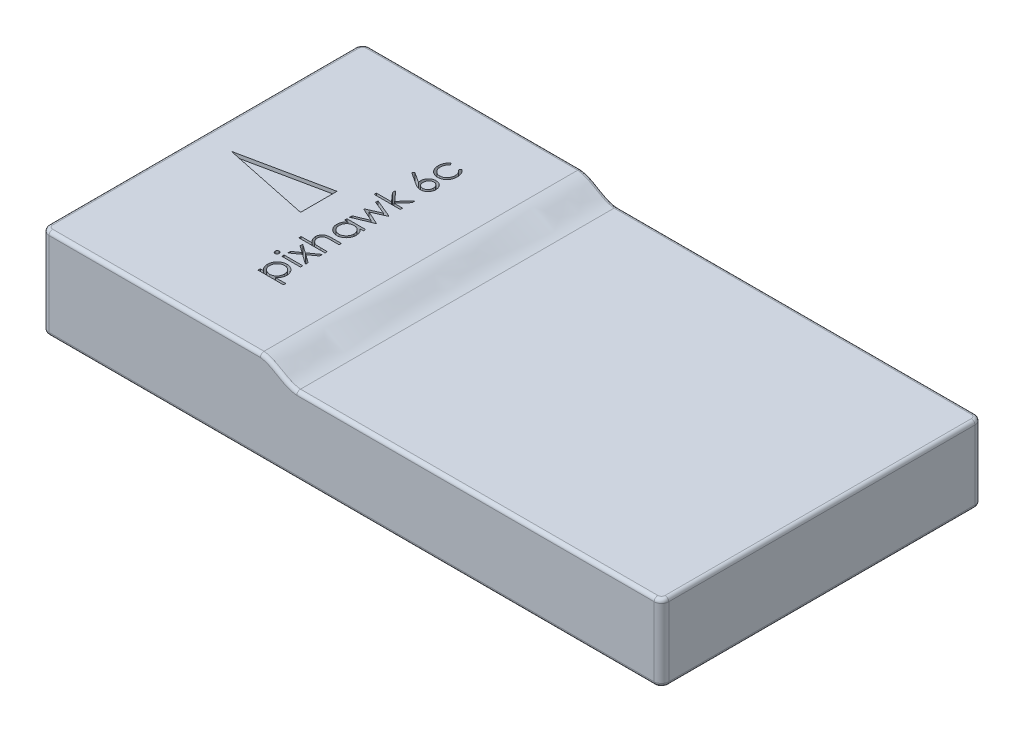
from build123d import *

# Parameters (mm, degrees)
SKETCH1_W               = 85
SKETCH1_H               = 44
BOSS_EXTRUDE1_DEPTH     = 15
CUT_EXTRUDE1_DEPTH      = 51.152268144
CUT_EXTRUDE1_DEPTH_BACK = 51.152268144
SKETCH3_W               = 2.557692308
SKETCH3_H               = 0.314102564
CUT_EXTRUDE2_DEPTH      = 2
FILLET1_R               = 1
FILLET2_R               = 0.5
FILLET3_R               = 0.5
CUT_EXTRUDE3_DEPTH      = 0.5


with BuildPart() as part:
    # Sketch1 → Boss-Extrude1 (new body)
    with BuildSketch(Plane(origin=(0, 0, 0), x_dir=(1, 0, 0), z_dir=(0, 1, 0))):
        Rectangle(SKETCH1_W, SKETCH1_H)
    extrude(amount=BOSS_EXTRUDE1_DEPTH)

    # Sketch2 → Cut-Extrude1 (cut, two sides: drawn at the far end of the back side and taken through both)
    with BuildSketch(Plane.XY.offset(-CUT_EXTRUDE1_DEPTH_BACK)):
        with BuildLine():
            Line((-42.5, 12.5), (-12.5, 12.5))
            add(Edge.make_bspline(
                [(-12.5, 12.5), (-10.623415355, 12.323006837), (-9.376584645, 10.676993163), (-7.5, 10.5)],
                knots=[0, 0, 0, 0, 1, 1, 1, 1], degree=3))
            Line((-7.5, 10.5), (42.5, 10.5))
            Line((42.5, 10.5), (42.5, 22.5))
            Line((42.5, 22.5), (-42.5, 22.5))
            Line((-42.5, 22.5), (-42.5, 12.5))
        make_face()
    extrude(amount=CUT_EXTRUDE1_DEPTH + CUT_EXTRUDE1_DEPTH_BACK, mode=Mode.SUBTRACT)

    # Sketch3 → Cut-Extrude2 (cut)
    # profile 1 of 10: a face of its own
    with BuildSketch(Plane(origin=(0, 12.5, 0), x_dir=(1, 0, 0), z_dir=(0, 1, 0))):
        with BuildLine():
            Line((-22.003104968, 13.653846154), (-21.83974359, 13.390925481))
            add(Edge.make_bspline(
                [(-21.83974359, 13.390925481), (-21.875571984, 13.362095615), (-21.946094094, 13.30534892), (-22.037104027, 13.206809684), (-22.115271069, 13.10179827), (-22.17897482, 12.988520222), (-22.22819627, 12.867134422), (-22.263026476, 12.738119571), (-22.284730719, 12.601494066), (-22.287197555, 12.507828867), (-22.288461538, 12.459835737)],
                knots=[0, 0, 0, 0, 1.026593902, 2.0206758, 2.988051866, 3.946915611, 4.916868779, 5.907761954, 6.927957743, 8, 8, 8, 8], degree=3))
            add(Edge.make_bspline(
                [(-22.288461538, 12.459835737), (-22.287404696, 12.42147678), (-22.285323274, 12.345929858), (-22.272312781, 12.235023704), (-22.248670773, 12.129381351), (-22.217519816, 12.028340642), (-22.175769526, 11.932620224), (-22.12495977, 11.841969305), (-22.06590973, 11.755583815), (-21.997499184, 11.675967074), (-21.923100516, 11.603138067), (-21.843346821, 11.540039153), (-21.76062693, 11.48510222), (-21.672875188, 11.441996263), (-21.582099134, 11.406721093), (-21.486585279, 11.383514373), (-21.387557271, 11.368049677), (-21.320038931, 11.366280348), (-21.285857372, 11.365384615)],
                knots=[0, 0, 0, 0, 1.112346261, 2.190735716, 3.231507886, 4.247384806, 5.251966152, 6.253067467, 7.256802811, 8.280671706, 9.291813951, 10.270744147, 11.225547591, 12.165006084, 13.100104208, 14.043489273, 15.009504848, 16, 16, 16, 16], degree=3))
            add(Edge.make_bspline(
                [(-21.285857372, 11.365384615), (-21.241094559, 11.367190834), (-21.151943011, 11.370788176), (-21.020567246, 11.39814875), (-20.89378287, 11.443930198), (-20.772275303, 11.505778812), (-20.65969093, 11.584285426), (-20.558704882, 11.676450175), (-20.471289548, 11.782371348), (-20.398816831, 11.901103103), (-20.340555516, 12.029861005), (-20.299048169, 12.167251066), (-20.273995801, 12.312150859), (-20.270839857, 12.411357604), (-20.269230769, 12.461939103)],
                knots=[0, 0, 0, 0, 0.96628757, 1.924499989, 2.884001032, 3.87047137, 4.860396324, 5.839257425, 6.814467993, 7.816059692, 8.834901047, 9.858382822, 10.908076205, 12, 12, 12, 12], degree=3))
            add(Edge.make_bspline(
                [(-20.269230769, 12.461939103), (-20.270530266, 12.508294287), (-20.273084123, 12.599394525), (-20.294613087, 12.73256181), (-20.32985672, 12.859341721), (-20.37900437, 12.979729752), (-20.442531886, 13.093505918), (-20.520891057, 13.199935093), (-20.611827657, 13.301135031), (-20.682145629, 13.360632008), (-20.717948718, 13.390925481)],
                knots=[0, 0, 0, 0, 1.039848629, 2.043578496, 3.018386758, 3.987534228, 4.954977003, 5.934852016, 6.948509513, 8, 8, 8, 8], degree=3))
            Line((-20.717948718, 13.390925481), (-20.545472756, 13.653846154))
            add(Edge.make_bspline(
                [(-20.545472756, 13.653846154), (-20.522582029, 13.638258452), (-20.476876553, 13.607134785), (-20.412432436, 13.555107159), (-20.352110754, 13.498987328), (-20.295992364, 13.438994231), (-20.242734345, 13.375911221), (-20.19488277, 13.307583311), (-20.149747947, 13.2362137), (-20.109135075, 13.160964542), (-20.072628754, 13.082613844), (-20.041237583, 13.001271854), (-20.014267477, 12.917292042), (-19.99283013, 12.830575666), (-19.975719292, 12.740951767), (-19.96436559, 12.648652133), (-19.955890309, 12.553708551), (-19.955384442, 12.4895364), (-19.955128205, 12.45703125)],
                knots=[0, 0, 0, 0, 0.954134338, 1.905101784, 2.851144739, 3.791306361, 4.734911809, 5.6936923, 6.663572882, 7.643865596, 8.638447847, 9.640600242, 10.646758161, 11.676244097, 12.717260333, 13.78922464, 14.880174919, 16, 16, 16, 16], degree=3))
            add(Edge.make_bspline(
                [(-19.955128205, 12.45703125), (-19.956020966, 12.407421015), (-19.957770783, 12.310184595), (-19.976958368, 12.167852931), (-20.005991844, 12.031872514), (-20.047309347, 11.902004379), (-20.101873852, 11.77904249), (-20.166998533, 11.661963185), (-20.244835572, 11.551974645), (-20.333535822, 11.449797919), (-20.429805581, 11.356357336), (-20.533088574, 11.275049334), (-20.641102547, 11.206143342), (-20.754528339, 11.149380838), (-20.87290085, 11.104997856), (-20.996943228, 11.074441753), (-21.125603037, 11.054725918), (-21.213334882, 11.052440629), (-21.2578125, 11.051282051)],
                knots=[0, 0, 0, 0, 1.113096611, 2.181677437, 3.217994567, 4.231807234, 5.234933164, 6.233258928, 7.234764453, 8.254006763, 9.267004511, 10.242118657, 11.199842941, 12.138404996, 13.084707599, 14.031460992, 15.002005182, 16, 16, 16, 16], degree=3))
            add(Edge.make_bspline(
                [(-21.2578125, 11.051282051), (-21.287990935, 11.051723067), (-21.348020822, 11.052600321), (-21.437115889, 11.062662249), (-21.525024434, 11.075660722), (-21.610632153, 11.097686459), (-21.695237443, 11.123127091), (-21.777820545, 11.155602623), (-21.858765217, 11.193698017), (-21.937862947, 11.236949965), (-22.013812487, 11.28563871), (-22.085566151, 11.339519943), (-22.153985917, 11.396564279), (-22.216709677, 11.459440391), (-22.276245869, 11.525480045), (-22.331003993, 11.596551621), (-22.381144984, 11.672247473), (-22.427595999, 11.751430795), (-22.468955434, 11.834055506), (-22.504588672, 11.919622177), (-22.535041248, 12.007615206), (-22.559150167, 12.09817535), (-22.579367591, 12.190701523), (-22.592085437, 12.285922861), (-22.60107171, 12.383475084), (-22.602062502, 12.449531106), (-22.602564103, 12.482972756)],
                knots=[0, 0, 0, 0, 0.990994727, 1.971252077, 2.943264845, 3.907940874, 4.872158414, 5.844625996, 6.82015047, 7.809835459, 8.804511986, 9.781214284, 10.756496977, 11.728388426, 12.696359165, 13.676225489, 14.672885716, 15.677705647, 16.690706858, 17.706033469, 18.721040654, 19.747369689, 20.783475414, 21.830280724, 22.901553713, 24, 24, 24, 24], degree=3))
            add(Edge.make_bspline(
                [(-22.602564103, 12.482972756), (-22.601642307, 12.524852917), (-22.599803323, 12.6084039), (-22.584323254, 12.732343834), (-22.560992168, 12.854461935), (-22.526399552, 12.972598247), (-22.484607014, 13.08538355), (-22.43739326, 13.190679098), (-22.38372785, 13.28689472), (-22.323939338, 13.37487909), (-22.255830681, 13.45460783), (-22.180095138, 13.528124413), (-22.096187562, 13.595913209), (-22.034388568, 13.6343758), (-22.003104968, 13.653846154)],
                knots=[0, 0, 0, 0, 1.095139042, 2.184804066, 3.262657822, 4.34424993, 5.400369085, 6.407210964, 7.359649996, 8.278719237, 9.185177137, 10.097389079, 11.036869154, 12, 12, 12, 12], degree=3))
        make_face()
    # profile 2 of 10: a face of its own
    with BuildSketch(Plane(origin=(0, 12.5, 0), x_dir=(1, 0, 0), z_dir=(0, 1, 0))):
        with BuildLine():
            Line((-23.58974359, 9.83974359), (-23.399739583, 10.081630609))
            Line((-23.399739583, 10.081630609), (-21.985576923, 9.156850962))
            add(Edge.make_bspline(
                [(-21.985576923, 9.156850962), (-21.995390784, 9.218421239), (-22.014533829, 9.338521025), (-22.017691774, 9.460086924), (-22.019230769, 9.519330929)],
                knots=[0, 0, 0, 0, 1.025318673, 2, 2, 2, 2], degree=3))
            add(Edge.make_bspline(
                [(-22.019230769, 9.519330929), (-22.018274658, 9.554903426), (-22.01639258, 9.624926826), (-22.001908729, 9.727733628), (-21.979083619, 9.826522567), (-21.945811357, 9.920884166), (-21.903309025, 10.0111572), (-21.852370067, 10.097859398), (-21.790364723, 10.179362165), (-21.721098473, 10.256710428), (-21.644386305, 10.326948381), (-21.56296755, 10.389085175), (-21.476848647, 10.441564888), (-21.386048964, 10.483375767), (-21.291279266, 10.516790063), (-21.192169945, 10.540576975), (-21.088553728, 10.554797149), (-21.018073453, 10.556717055), (-20.982271635, 10.557692308)],
                knots=[0, 0, 0, 0, 1.043709831, 2.054511743, 3.041122595, 4.01515914, 4.98481438, 5.965901842, 6.960491961, 7.985277438, 9.0096037, 10.00832444, 10.987059228, 11.962929573, 12.936966118, 13.931840027, 14.949438142, 16, 16, 16, 16], degree=3))
            add(Edge.make_bspline(
                [(-20.982271635, 10.557692308), (-20.933290098, 10.556272661), (-20.836906025, 10.553479133), (-20.696555504, 10.525525931), (-20.562926162, 10.482413619), (-20.438330275, 10.419805153), (-20.321904881, 10.343512353), (-20.219084187, 10.249331286), (-20.127384518, 10.141934693), (-20.050736149, 10.020434838), (-19.988130859, 9.889695417), (-19.943166211, 9.75234248), (-19.915482586, 9.60971558), (-19.912012004, 9.512910939), (-19.91025641, 9.463942308)],
                knots=[0, 0, 0, 0, 1.031403119, 2.029557249, 3.004870281, 3.983165322, 4.960181699, 5.929903783, 6.912123683, 7.928973898, 8.949315281, 9.960468141, 10.968302741, 12, 12, 12, 12], degree=3))
            add(Edge.make_bspline(
                [(-19.91025641, 9.463942308), (-19.911780273, 9.416843625), (-19.914798779, 9.32354938), (-19.941828234, 9.186345578), (-19.985326767, 9.054275989), (-20.046510348, 8.929035908), (-20.122487554, 8.812827334), (-20.213316504, 8.708030565), (-20.319123382, 8.617454236), (-20.437593599, 8.541397383), (-20.564720568, 8.480818115), (-20.69750636, 8.43581331), (-20.835393511, 8.409386314), (-20.928876381, 8.405701905), (-20.975961538, 8.403846154)],
                knots=[0, 0, 0, 0, 1.012172929, 2.004937354, 2.995255351, 3.995689452, 4.993936421, 5.973737378, 6.968231049, 7.979117505, 8.993136101, 9.989812463, 10.987515067, 12, 12, 12, 12], degree=3))
            add(Edge.make_bspline(
                [(-20.975961538, 8.403846154), (-21.012006122, 8.405027599), (-21.085602274, 8.407439884), (-21.197066302, 8.424283274), (-21.311117383, 8.451348069), (-21.407871577, 8.481658315), (-21.487133099, 8.513683925), (-21.55103659, 8.540336465), (-21.616797663, 8.573510461), (-21.686671299, 8.608883842), (-21.758856731, 8.649640711), (-21.834560401, 8.69395636), (-21.912578329, 8.743056011), (-21.965522524, 8.777476174), (-21.992588141, 8.795072115)],
                knots=[0, 0, 0, 0, 1.173818275, 2.396712641, 3.66331629, 4.989737886, 5.693666774, 6.447286557, 7.243889047, 8.091586357, 8.998013824, 9.943181721, 10.948533338, 12, 12, 12, 12], degree=3))
            Line((-21.992588141, 8.795072115), (-23.58974359, 9.83974359))
        make_face()
        with BuildLine():
            add(Edge.make_bspline(
                [(-21.66025641, 9.453425481), (-21.659485878, 9.426760638), (-21.657980805, 9.374676455), (-21.649050486, 9.298305374), (-21.632796287, 9.225790619), (-21.610258424, 9.157111143), (-21.582471876, 9.091843263), (-21.546819296, 9.031280409), (-21.505292177, 8.974176334), (-21.457965644, 8.921443412), (-21.406184395, 8.873620935), (-21.350713106, 8.832440537), (-21.292899361, 8.796917947), (-21.232257298, 8.768036178), (-21.168810831, 8.745546089), (-21.102851573, 8.729277841), (-21.033937269, 8.720224089), (-20.987204766, 8.718717858), (-20.963341346, 8.717948718)],
                knots=[0, 0, 0, 0, 1.129656352, 2.206547016, 3.251334079, 4.271920891, 5.265058649, 6.249872215, 7.241923875, 8.251504132, 9.246416584, 10.222533834, 11.173322129, 12.116503788, 13.062124155, 14.020151864, 14.989013135, 16, 16, 16, 16], degree=3))
            add(Edge.make_bspline(
                [(-20.963341346, 8.717948718), (-20.939695498, 8.71859726), (-20.893098454, 8.719875292), (-20.824698752, 8.73075645), (-20.759026586, 8.748148846), (-20.696328765, 8.773273334), (-20.635401654, 8.803804591), (-20.578147176, 8.84299381), (-20.522710735, 8.887971647), (-20.471668092, 8.940487381), (-20.424282184, 8.997277678), (-20.382692201, 9.057824189), (-20.347523558, 9.121215284), (-20.318382451, 9.187268393), (-20.29693044, 9.256800015), (-20.280507759, 9.328681134), (-20.271529256, 9.403889056), (-20.270006987, 9.454806157), (-20.269230769, 9.480769231)],
                knots=[0, 0, 0, 0, 0.989367052, 1.949669134, 2.891858276, 3.827522767, 4.772653562, 5.738670152, 6.725809442, 7.756636004, 8.798867547, 9.819240912, 10.826537776, 11.829883227, 12.835515726, 13.868058748, 14.912904531, 16, 16, 16, 16], degree=3))
            add(Edge.make_bspline(
                [(-20.269230769, 9.480769231), (-20.270007048, 9.506732262), (-20.271529435, 9.557649279), (-20.280507079, 9.632857807), (-20.296932933, 9.70473669), (-20.318373419, 9.774276434), (-20.34755727, 9.840299422), (-20.382472115, 9.903635107), (-20.424537191, 9.963608979), (-20.471586732, 10.020436234), (-20.523002402, 10.072733721), (-20.577647666, 10.118769389), (-20.635859778, 10.156734252), (-20.696089201, 10.188476052), (-20.759064035, 10.213322349), (-20.824688531, 10.23080037), (-20.893101121, 10.24165838), (-20.939696396, 10.242939589), (-20.963341346, 10.243589744)],
                knots=[0, 0, 0, 0, 1.087281468, 2.132306021, 3.165025708, 4.170830268, 5.174347389, 6.181816599, 7.194310624, 8.23672049, 9.267723423, 10.261267456, 11.222032883, 12.171822355, 13.107646935, 14.049997283, 15.01046367, 16, 16, 16, 16], degree=3))
            add(Edge.make_bspline(
                [(-20.963341346, 10.243589744), (-20.987235897, 10.243039451), (-21.03413313, 10.241959405), (-21.102820746, 10.229743455), (-21.169145961, 10.212801085), (-21.232691878, 10.187218041), (-21.293207925, 10.153981544), (-21.350999064, 10.113497955), (-21.406511223, 10.066666098), (-21.458066973, 10.012565777), (-21.505240868, 9.953686113), (-21.546762184, 9.891031807), (-21.582204948, 9.825745325), (-21.610172096, 9.75690701), (-21.632702747, 9.685443077), (-21.648992533, 9.610860057), (-21.657957526, 9.533104904), (-21.659480355, 9.480323583), (-21.66025641, 9.453425481)],
                knots=[0, 0, 0, 0, 0.978259475, 1.920005202, 2.851759169, 3.7803069, 4.719124913, 5.675758531, 6.668034766, 7.691045932, 8.733780038, 9.756656648, 10.768121246, 11.773215211, 12.79725739, 13.836288844, 14.897342417, 16, 16, 16, 16], degree=3))
        make_face(mode=Mode.SUBTRACT)
    # profile 3 of 10: a face of its own
    with BuildSketch(Plane(origin=(0, 12.5, 0), x_dir=(1, 0, 0), z_dir=(0, 1, 0))):
        Polygon((-23.58974359, 4.679487179), (-23.58974359, 4.993589744), (-21.514423077, 4.993589744), (-22.557692308, 6.157451923), (-22.557692308, 6.608974359), (-21.346153846, 5.258613782), (-20, 6.743589744), (-20, 6.292768429), (-21.178585737, 4.993589744), (-20, 4.993589744), (-20, 4.679487179), align=None)
    # profile 4 of 10: a face of its own
    with BuildSketch(Plane(origin=(0, 12.5, 0), x_dir=(1, 0, 0), z_dir=(0, 1, 0))):
        Polygon((-22.557692308, 0.282051282), (-22.557692308, 0.619290865), (-20.717948718, 1.381410256), (-22.557692308, 2.216446314), (-22.557692308, 2.269731571), (-20.717948718, 3.086538462), (-22.557692308, 3.855669071), (-22.557692308, 4.185897436), (-20, 3.116686699), (-20, 3.051482372), (-21.83974359, 2.233974359), (-20, 1.399639423), (-20, 1.341446314), align=None)
    # profile 5 of 10: a face of its own
    with BuildSketch(Plane(origin=(0, 12.5, 0), x_dir=(1, 0, 0), z_dir=(0, 1, 0))):
        with BuildLine():
            Line((-22.557692308, -0.076923077), (-20, -0.076923077))
            Line((-20, -0.076923077), (-20, -0.391025641))
            Line((-20, -0.391025641), (-20.442407853, -0.391025641))
            add(Edge.make_bspline(
                [(-20.442407853, -0.391025641), (-20.402434233, -0.426499726), (-20.324309204, -0.495830799), (-20.22130842, -0.610535615), (-20.137906052, -0.733634187), (-20.069567916, -0.862037608), (-20.018442034, -0.997003623), (-19.982038003, -1.137826808), (-19.958649034, -1.284641703), (-19.956312344, -1.384893575), (-19.955128205, -1.435697115)],
                knots=[0, 0, 0, 0, 1.074325654, 2.099677833, 3.090439787, 4.057542011, 5.018572219, 5.985274637, 6.979019747, 8, 8, 8, 8], degree=3))
            add(Edge.make_bspline(
                [(-19.955128205, -1.435697115), (-19.956354577, -1.480865069), (-19.958773038, -1.569938274), (-19.977535341, -1.700967351), (-20.007665963, -1.827059601), (-20.049566853, -1.948334173), (-20.105147674, -2.064006319), (-20.171688922, -2.175066415), (-20.250929752, -2.280939107), (-20.341517781, -2.380010646), (-20.439912768, -2.471242647), (-20.544858315, -2.551303919), (-20.655900619, -2.618056999), (-20.771633773, -2.67387708), (-20.892948692, -2.716873424), (-21.01942586, -2.746847059), (-21.150915734, -2.765587505), (-21.240455257, -2.768004966), (-21.285857372, -2.769230769)],
                knots=[0, 0, 0, 0, 1.033919861, 2.038935746, 3.024066025, 3.998881131, 4.97069526, 5.957263378, 6.95902576, 7.993208707, 9.027059324, 10.027763471, 11.009749337, 11.988697705, 12.965288445, 13.950418724, 14.960734635, 16, 16, 16, 16], degree=3))
            add(Edge.make_bspline(
                [(-21.285857372, -2.769230769), (-21.330321075, -2.767977798), (-21.418223419, -2.765500741), (-21.547502117, -2.747047521), (-21.672020377, -2.716016513), (-21.791377321, -2.672468665), (-21.905717371, -2.61662671), (-22.015121396, -2.548698623), (-22.119890793, -2.468679498), (-22.21756202, -2.376427091), (-22.307782634, -2.276492321), (-22.38619168, -2.16958359), (-22.453908529, -2.058360309), (-22.507562005, -1.941097298), (-22.550971109, -1.819530193), (-22.581004078, -1.692576748), (-22.598701399, -1.560765169), (-22.601264163, -1.471274677), (-22.602564103, -1.42588141)],
                knots=[0, 0, 0, 0, 1.020392517, 2.01726096, 2.990465484, 3.961182959, 4.928053699, 5.906110375, 6.912531644, 7.948652711, 8.985773172, 9.998621852, 10.987621588, 11.969261332, 12.953316658, 13.946091881, 14.958173133, 16, 16, 16, 16], degree=3))
            add(Edge.make_bspline(
                [(-22.602564103, -1.42588141), (-22.60112475, -1.37368254), (-22.598302246, -1.271323019), (-22.574862161, -1.121581031), (-22.535141118, -0.979987531), (-22.481482841, -0.845039368), (-22.408686533, -0.718594067), (-22.319426341, -0.599077573), (-22.210011935, -0.489032607), (-22.127018146, -0.424259759), (-22.084435096, -0.391025641)],
                knots=[0, 0, 0, 0, 1.039007978, 2.037445607, 3.008437381, 3.96246474, 4.921201921, 5.904967172, 6.925065498, 8, 8, 8, 8], degree=3))
            Line((-22.084435096, -0.391025641), (-22.557692308, -0.391025641))
            Line((-22.557692308, -0.391025641), (-22.557692308, -0.076923077))
        make_face()
        with BuildLine():
            add(Edge.make_bspline(
                [(-22.288461538, -1.421674679), (-22.286826503, -1.467588029), (-22.283599202, -1.558213679), (-22.258445926, -1.691271971), (-22.216485352, -1.818531688), (-22.159435035, -1.939794939), (-22.086337296, -2.051680222), (-22.000214663, -2.153429659), (-21.899613419, -2.241905918), (-21.788133794, -2.317995287), (-21.667961498, -2.379078034), (-21.542380577, -2.422302303), (-21.413564365, -2.450756774), (-21.326203179, -2.453667267), (-21.282351763, -2.455128205)],
                knots=[0, 0, 0, 0, 1.031130969, 2.035288524, 3.029955243, 4.035265425, 5.037320146, 6.024362013, 7.021230137, 8.037832003, 9.049975902, 10.039737725, 11.016035826, 12, 12, 12, 12], degree=3))
            add(Edge.make_bspline(
                [(-21.282351763, -2.455128205), (-21.238764409, -2.453255786), (-21.151760548, -2.449518287), (-21.022955393, -2.422925292), (-20.897656365, -2.377725769), (-20.776518381, -2.316725618), (-20.663949475, -2.239740736), (-20.561541317, -2.151348624), (-20.474071536, -2.049109644), (-20.400797577, -1.936224035), (-20.341644806, -1.815604838), (-20.300476607, -1.688773853), (-20.273899498, -1.558097442), (-20.27079493, -1.469245212), (-20.269230769, -1.424479167)],
                knots=[0, 0, 0, 0, 0.979154007, 1.954470061, 2.941101473, 3.965068436, 4.993389179, 5.998216918, 6.996159742, 8.005560442, 9.015493761, 10.005250788, 10.994993882, 12, 12, 12, 12], degree=3))
            add(Edge.make_bspline(
                [(-20.269230769, -1.424479167), (-20.27090991, -1.379038856), (-20.274249554, -1.288662586), (-20.299260521, -1.155060958), (-20.342149827, -1.025850996), (-20.399788619, -0.901914116), (-20.471579217, -0.786569342), (-20.555626614, -0.683396716), (-20.652700961, -0.595124594), (-20.760626239, -0.521631593), (-20.878190217, -0.463348053), (-21.00322951, -0.420731873), (-21.135997919, -0.395815324), (-21.226858223, -0.392644278), (-21.273237179, -0.391025641)],
                knots=[0, 0, 0, 0, 1.01787422, 2.024450869, 3.03297362, 4.061474925, 5.080076323, 6.069755756, 7.033548292, 8.009625779, 8.9862229, 9.964937832, 10.961217871, 12, 12, 12, 12], degree=3))
            add(Edge.make_bspline(
                [(-21.273237179, -0.391025641), (-21.30857501, -0.391985297), (-21.378131043, -0.393874205), (-21.480258561, -0.408304774), (-21.577992287, -0.431259701), (-21.671434976, -0.463605871), (-21.760069991, -0.506097155), (-21.844533752, -0.557344921), (-21.924386963, -0.618250371), (-21.998530034, -0.687833067), (-22.066156496, -0.763998269), (-22.126520737, -0.84459281), (-22.17610951, -0.930571557), (-22.217150781, -1.020488594), (-22.249809931, -1.114499928), (-22.271597625, -1.213370548), (-22.286557946, -1.316049535), (-22.287820327, -1.386095591), (-22.288461538, -1.421674679)],
                knots=[0, 0, 0, 0, 1.050140795, 2.067009409, 3.05949893, 4.030605086, 5.00011959, 5.97591094, 6.962425594, 7.979863591, 8.993523472, 9.986985069, 10.967611495, 11.937549037, 12.921786183, 13.919465291, 14.943216303, 16, 16, 16, 16], degree=3))
        make_face(mode=Mode.SUBTRACT)
    # profile 6 of 10: a face of its own
    with BuildSketch(Plane(origin=(0, 12.5, 0), x_dir=(1, 0, 0), z_dir=(0, 1, 0))):
        with BuildLine():
            Line((-23.58974359, -5.641025641), (-23.58974359, -5.326923077))
            Line((-23.58974359, -5.326923077), (-22.074619391, -5.326923077))
            add(Edge.make_bspline(
                [(-22.074619391, -5.326923077), (-22.116758649, -5.293202689), (-22.198805944, -5.227547365), (-22.305932252, -5.117093793), (-22.398578808, -5.003376928), (-22.47330898, -4.883424893), (-22.531768484, -4.758284445), (-22.572090464, -4.627776076), (-22.597801378, -4.492426271), (-22.600962655, -4.400390007), (-22.602564103, -4.353766026)],
                knots=[0, 0, 0, 0, 1.125633083, 2.191665293, 3.205031882, 4.182434329, 5.134135993, 6.080017564, 7.027370072, 8, 8, 8, 8], degree=3))
            add(Edge.make_bspline(
                [(-22.602564103, -4.353766026), (-22.600920104, -4.306411521), (-22.597700791, -4.213680872), (-22.569252665, -4.079173171), (-22.524495634, -3.952778742), (-22.46094665, -3.8363589), (-22.382462033, -3.731168864), (-22.29090295, -3.639099208), (-22.186256286, -3.562513818), (-22.089011674, -3.511199263), (-22.002495363, -3.477597584), (-21.92825358, -3.456352397), (-21.845533277, -3.438331171), (-21.75436805, -3.422632058), (-21.65432303, -3.412168286), (-21.54584873, -3.403763725), (-21.428951625, -3.397787254), (-21.348031374, -3.397555652), (-21.306189904, -3.397435897)],
                knots=[0, 0, 0, 0, 1.235771509, 2.41991536, 3.57472251, 4.727526861, 5.870395018, 6.992794988, 8.106410512, 9.245194824, 9.854018721, 10.52826073, 11.259975989, 12.064917182, 12.943387139, 13.886414983, 14.90712766, 16, 16, 16, 16], degree=3))
            Line((-21.306189904, -3.397435897), (-20, -3.397435897))
            Line((-20, -3.397435897), (-20, -3.711538462))
            Line((-20, -3.711538462), (-21.203125, -3.711538462))
            add(Edge.make_bspline(
                [(-21.203125, -3.711538462), (-21.237947714, -3.711728004), (-21.30455764, -3.712090566), (-21.399923168, -3.713303784), (-21.486187924, -3.715950472), (-21.563530982, -3.720385512), (-21.631847524, -3.724848199), (-21.691249138, -3.731175125), (-21.741363179, -3.738481414), (-21.771527779, -3.745050618), (-21.78505609, -3.747996795)],
                knots=[0, 0, 0, 0, 1.430934443, 2.737134061, 3.918973087, 4.976914145, 5.92044225, 6.731742364, 7.431207999, 8, 8, 8, 8], degree=3))
            add(Edge.make_bspline(
                [(-21.78505609, -3.747996795), (-21.824779337, -3.759368057), (-21.900945293, -3.781171488), (-22.004223756, -3.832860954), (-22.093069058, -3.895921883), (-22.165000229, -3.974072797), (-22.221441909, -4.064587062), (-22.26050117, -4.168459493), (-22.284751377, -4.284639926), (-22.287190319, -4.366491927), (-22.288461538, -4.409154647)],
                knots=[0, 0, 0, 0, 1.090133324, 2.090238182, 3.036763777, 3.954757083, 4.878717367, 5.838952881, 6.873623762, 8, 8, 8, 8], degree=3))
            add(Edge.make_bspline(
                [(-22.288461538, -4.409154647), (-22.287992561, -4.434424667), (-22.287064468, -4.484433383), (-22.277510699, -4.558549292), (-22.26242181, -4.630668443), (-22.240134178, -4.70059727), (-22.21303663, -4.768478419), (-22.179782519, -4.83458782), (-22.139574719, -4.898020724), (-22.09432124, -4.959595866), (-22.044258929, -5.016916269), (-21.991410046, -5.070242642), (-21.935135586, -5.117781176), (-21.876335337, -5.160849716), (-21.814203579, -5.198028015), (-21.749339251, -5.230481093), (-21.681657108, -5.258016791), (-21.634682046, -5.271699483), (-21.611177885, -5.278545673)],
                knots=[0, 0, 0, 0, 1.024369801, 2.02720137, 3.025498567, 4.008789058, 4.999724648, 5.987391013, 7.005161842, 8.042127274, 9.083588116, 10.088924978, 11.084112559, 12.068088063, 13.041783903, 14.016724555, 15.007660144, 16, 16, 16, 16], degree=3))
            add(Edge.make_bspline(
                [(-21.611177885, -5.278545673), (-21.594156934, -5.2824851), (-21.557066187, -5.291069597), (-21.495891863, -5.30038443), (-21.424805491, -5.308722227), (-21.34391489, -5.315770777), (-21.252923648, -5.320093863), (-21.152452689, -5.324752104), (-21.041872668, -5.326486118), (-20.964977161, -5.326773071), (-20.924779647, -5.326923077)],
                knots=[0, 0, 0, 0, 0.607992626, 1.324890765, 2.152360218, 3.099583803, 4.150613268, 5.323148443, 6.60066238, 8, 8, 8, 8], degree=3))
            Line((-20.924779647, -5.326923077), (-20, -5.326923077))
            Line((-20, -5.326923077), (-20, -5.641025641))
            Line((-20, -5.641025641), (-23.58974359, -5.641025641))
        make_face()
    # profile 7 of 10: a face of its own
    with BuildSketch(Plane(origin=(0, 12.5, 0), x_dir=(1, 0, 0), z_dir=(0, 1, 0))):
        Polygon((-22.557692308, -8.198717949), (-22.557692308, -7.825020032), (-21.635016026, -7.166666667), (-22.557692308, -6.508313301), (-22.557692308, -6.134615385), (-21.373497596, -6.979467147), (-20, -6), (-20, -6.373697917), (-21.111278045, -7.166666667), (-20, -7.959635417), (-20, -8.333333333), (-21.373497596, -7.353165064), align=None)
    # profile 8 of 10: a face of its own
    with BuildSketch(Plane(origin=(0, 12.5, 0), x_dir=(1, 0, 0), z_dir=(0, 1, 0))):
        with BuildLine():
            add(Edge.make_bspline(
                [(-23.634615385, -8.850761218), (-23.633711232, -8.831269902), (-23.631940728, -8.793102162), (-23.616779251, -8.737908895), (-23.591079566, -8.687651883), (-23.556599885, -8.64307415), (-23.516050441, -8.604822263), (-23.468789473, -8.578041553), (-23.417730834, -8.560829157), (-23.382115745, -8.558750601), (-23.363982372, -8.557692308)],
                knots=[0, 0, 0, 0, 1.055194115, 2.066272739, 3.074728998, 4.095836921, 5.109056067, 6.073838105, 7.019297344, 8, 8, 8, 8], degree=3))
            add(Edge.make_bspline(
                [(-23.363982372, -8.557692308), (-23.346319719, -8.558774468), (-23.311402744, -8.560913769), (-23.261229272, -8.578028258), (-23.214624988, -8.605050496), (-23.174154278, -8.643049621), (-23.139693658, -8.687658382), (-23.113988919, -8.737907168), (-23.098828782, -8.793102617), (-23.097058093, -8.831270056), (-23.096153846, -8.850761218)],
                knots=[0, 0, 0, 0, 0.96129708, 1.900370562, 2.859976407, 3.87933698, 4.906634145, 5.921202961, 6.938410037, 8, 8, 8, 8], degree=3))
            add(Edge.make_bspline(
                [(-23.096153846, -8.850761218), (-23.097023566, -8.870029493), (-23.098716363, -8.907532673), (-23.114286381, -8.961899516), (-23.139702454, -9.011728005), (-23.173928639, -9.056392678), (-23.214873536, -9.093622871), (-23.26120083, -9.120721196), (-23.311409985, -9.137796158), (-23.346322151, -9.139940787), (-23.363982372, -9.141025641)],
                knots=[0, 0, 0, 0, 1.054934014, 2.053291228, 3.073705704, 4.106921865, 5.123545215, 6.088680038, 7.033164197, 8, 8, 8, 8], degree=3))
            add(Edge.make_bspline(
                [(-23.363982372, -9.141025641), (-23.382113221, -9.139964554), (-23.417723354, -9.137880513), (-23.468818387, -9.120708397), (-23.515799889, -9.093848589), (-23.556825388, -9.056368026), (-23.591070823, -9.011734566), (-23.616481804, -8.96189782), (-23.632053144, -8.907533121), (-23.633745758, -8.870029645), (-23.634615385, -8.850761218)],
                knots=[0, 0, 0, 0, 0.98631895, 1.937192651, 2.907499808, 3.917963147, 4.944918757, 5.95915025, 6.951458133, 8, 8, 8, 8], degree=3))
        make_face()
    # profile 9 of 10: a face of its own
    with BuildSketch(Plane(origin=(0, 12.5, 0), x_dir=(1, 0, 0), z_dir=(0, 1, 0))):
        with Locations((-21.278846154, -8.849358974)):
            Rectangle(SKETCH3_W, SKETCH3_H)
    # profile 10 of 10: a face of its own
    with BuildSketch(Plane(origin=(0, 12.5, 0), x_dir=(1, 0, 0), z_dir=(0, 1, 0))):
        with BuildLine():
            Line((-22.557692308, -12.282051282), (-22.557692308, -11.967948718))
            Line((-22.557692308, -11.967948718), (-22.084435096, -11.967948718))
            add(Edge.make_bspline(
                [(-22.084435096, -11.967948718), (-22.127042337, -11.934495085), (-22.210103827, -11.86927827), (-22.318970963, -11.758574897), (-22.408927714, -11.639634315), (-22.481456368, -11.513206592), (-22.535018123, -11.378489044), (-22.574879734, -11.237407494), (-22.598298713, -11.088354829), (-22.601123494, -10.986460305), (-22.602564103, -10.934495192)],
                knots=[0, 0, 0, 0, 1.07939028, 2.104237756, 3.085658289, 4.045737152, 5.001099604, 5.968961907, 6.964192404, 8, 8, 8, 8], degree=3))
            add(Edge.make_bspline(
                [(-22.602564103, -10.934495192), (-22.601250924, -10.889103589), (-22.598655357, -10.799384701), (-22.581082302, -10.667321472), (-22.55096461, -10.540146088), (-22.507563694, -10.418578034), (-22.453908224, -10.301314969), (-22.386191189, -10.190092869), (-22.307784998, -10.083179314), (-22.217552847, -9.983263125), (-22.119924581, -9.890941757), (-22.014902277, -9.811095576), (-21.90593969, -9.742223672), (-21.791347598, -9.686553375), (-21.672028368, -9.642945028), (-21.547499927, -9.61193035), (-21.418223987, -9.593472707), (-21.330321266, -9.590996255), (-21.285857372, -9.58974359)],
                knots=[0, 0, 0, 0, 1.041296284, 2.058176809, 3.050446431, 4.034000596, 5.01514041, 6.003636468, 7.015969324, 8.052561599, 9.08815499, 10.094063707, 11.074456064, 12.040834395, 13.011057502, 13.983766392, 14.980127149, 16, 16, 16, 16], degree=3))
            add(Edge.make_bspline(
                [(-21.285857372, -9.58974359), (-21.240455063, -9.590969075), (-21.150915159, -9.59338591), (-21.019428062, -9.612130916), (-20.892940688, -9.64208779), (-20.771663424, -9.685145973), (-20.655679773, -9.740787461), (-20.545073377, -9.808492022), (-20.439879674, -9.888378489), (-20.341526774, -9.979679616), (-20.250927461, -10.078732552), (-20.171689391, -10.184610042), (-20.105148016, -10.295668968), (-20.049565056, -10.411341135), (-20.007672872, -10.532616773), (-19.977455071, -10.658930051), (-19.958820576, -10.790212197), (-19.956368433, -10.879513349), (-19.955128205, -10.924679487)],
                knots=[0, 0, 0, 0, 1.038740735, 2.04854663, 3.033179607, 4.009277356, 4.987731542, 5.972001279, 6.972200261, 8.005528982, 9.039189865, 10.040446548, 11.026516639, 11.997840187, 12.972163198, 13.956796175, 14.96660207, 16, 16, 16, 16], degree=3))
            add(Edge.make_bspline(
                [(-19.955128205, -10.924679487), (-19.956523944, -10.975487872), (-19.959279891, -11.075811244), (-19.983740706, -11.222911644), (-20.02391459, -11.363843535), (-20.080254687, -11.498192839), (-20.152613938, -11.626333755), (-20.240695462, -11.747760998), (-20.344483983, -11.863075703), (-20.423214701, -11.932484745), (-20.463441506, -11.967948718)],
                knots=[0, 0, 0, 0, 1.014661154, 2.003492687, 2.970165371, 3.937187664, 4.907406957, 5.904113462, 6.929124205, 8, 8, 8, 8], degree=3))
            Line((-20.463441506, -11.967948718), (-19.057692308, -11.967948718))
            Line((-19.057692308, -11.967948718), (-19.057692308, -12.282051282))
            Line((-19.057692308, -12.282051282), (-22.557692308, -12.282051282))
        make_face()
        with BuildLine():
            add(Edge.make_bspline(
                [(-22.288461538, -10.937299679), (-22.28782128, -10.972879242), (-22.286560777, -11.04292623), (-22.271586828, -11.145598449), (-22.249849087, -11.244493876), (-22.216937187, -11.338615828), (-22.176538373, -11.428866444), (-22.126056362, -11.514550609), (-22.066404356, -11.595608177), (-21.998725013, -11.671835207), (-21.924150324, -11.740698501), (-21.844562515, -11.801661429), (-21.760062376, -11.852868734), (-21.671437013, -11.895370754), (-21.577991728, -11.927714037), (-21.480258715, -11.950669756), (-21.378131003, -11.965100109), (-21.308574996, -11.966989046), (-21.273237179, -11.967948718)],
                knots=[0, 0, 0, 0, 1.05670511, 2.080379991, 3.077984906, 4.06214886, 5.038337365, 6.01289324, 7.01187578, 8.025460281, 9.038092164, 10.024533457, 11.000252242, 11.969694649, 12.940728589, 13.933144304, 14.949937299, 16, 16, 16, 16], degree=3))
            add(Edge.make_bspline(
                [(-21.273237179, -11.967948718), (-21.226850838, -11.966351174), (-21.135976066, -11.96322145), (-21.003385607, -11.938020397), (-20.878026807, -11.896546114), (-20.760715467, -11.837908381), (-20.652178958, -11.764661733), (-20.556123168, -11.674808442), (-20.47128982, -11.57168937), (-20.399835981, -11.455593379), (-20.342108841, -11.331022273), (-20.299475735, -11.201519295), (-20.274171087, -11.067993237), (-20.270886459, -10.977837058), (-20.269230769, -10.932391827)],
                knots=[0, 0, 0, 0, 1.037533453, 2.032615907, 3.008487753, 3.983910949, 4.958815134, 5.928528047, 6.917017829, 7.938835504, 8.970843303, 9.983125212, 10.983349323, 12, 12, 12, 12], degree=3))
            add(Edge.make_bspline(
                [(-20.269230769, -10.932391827), (-20.270787191, -10.887856111), (-20.27387641, -10.799460722), (-20.30061393, -10.669301832), (-20.341461508, -10.542814134), (-20.401011352, -10.422622778), (-20.474037785, -10.309841173), (-20.561578008, -10.20767091), (-20.663735165, -10.119159493), (-20.776729045, -10.042997622), (-20.897782978, -9.982109294), (-21.022806897, -9.935857743), (-21.151778239, -9.90950786), (-21.238770313, -9.905735858), (-21.282351763, -9.903846154)],
                knots=[0, 0, 0, 0, 1.001123591, 1.987050352, 2.978152323, 3.984730168, 4.995502505, 5.994801396, 7.000994558, 8.027767845, 9.053126238, 10.042874082, 11.019515457, 12, 12, 12, 12], degree=3))
            add(Edge.make_bspline(
                [(-21.282351763, -9.903846154), (-21.326206005, -9.905301875), (-21.41357282, -9.908201977), (-21.542346872, -9.936734279), (-21.668191626, -9.979691381), (-21.787705752, -10.041941044), (-21.899860141, -10.116923896), (-22.000175763, -10.205605571), (-22.086347851, -10.307277621), (-22.159432177, -10.419183891), (-22.216486109, -10.540441487), (-22.258445723, -10.667702706), (-22.283599254, -10.800760598), (-22.28682652, -10.891386302), (-22.288461538, -10.937299679)],
                knots=[0, 0, 0, 0, 0.984010603, 1.960354772, 2.950163297, 3.964735994, 4.97843856, 5.975353722, 6.962442164, 7.964544167, 8.969901786, 9.964615439, 10.968820376, 12, 12, 12, 12], degree=3))
        make_face(mode=Mode.SUBTRACT)
    extrude(amount=-CUT_EXTRUDE2_DEPTH, mode=Mode.SUBTRACT)

    # Fillet1
    fillet1_edges = [part.edges().sort_by_distance(p)[0] for p in [
        (42.5, 5.25, -22),
        (42.5, 5.25, 22),
        (-42.5, 6.25, 22),
        (-42.5, 6.25, -22),
    ]]
    fillet(fillet1_edges, radius=FILLET1_R)

    # Fillet2
    fillet2_edges = [part.edges().sort_by_distance(p)[0] for p in [
        (17, 10.5, -22),
        (-9.999999993, 11.50000001, -22),
        (-9.999999993, 11.50000001, 22),
        (17, 10.5, 22),
        (-42.5, 12.5, 0),
        (-27, 12.5, -22),
        (-27, 12.5, 22),
        (-42.207106781, 12.5, 21.707106781),
        (-42.207106781, 12.5, -21.707106781),
        (42.5, 10.5, 0),
        (42.207106781, 10.5, 21.707106781),
        (42.207106781, 10.5, -21.707106781),
    ]]
    fillet(fillet2_edges, radius=FILLET2_R)

    # Fillet3
    fillet3_edges = [part.edges().sort_by_distance(p)[0] for p in [
        (-42.5, 0, 0),
        (0, 0, -22),
        (42.5, 0, 0),
        (0, 0, 22),
        (-42.207106781, 0, 21.707106781),
        (42.207106781, 0, 21.707106781),
        (42.207106781, 0, -21.707106781),
        (-42.207106781, 0, -21.707106781),
    ]]
    fillet(fillet3_edges, radius=FILLET3_R)

    # Sketch4 → Cut-Extrude3 (cut)
    with BuildSketch(Plane(origin=(0, 12.5, 0), x_dir=(1, 0, 0), z_dir=(0, 1, 0))):
        Polygon((-38.5, 0), (-26.5, 2.5), (-26.5, -2.5), align=None)
    extrude(amount=-CUT_EXTRUDE3_DEPTH, mode=Mode.SUBTRACT)


solid = part.part
